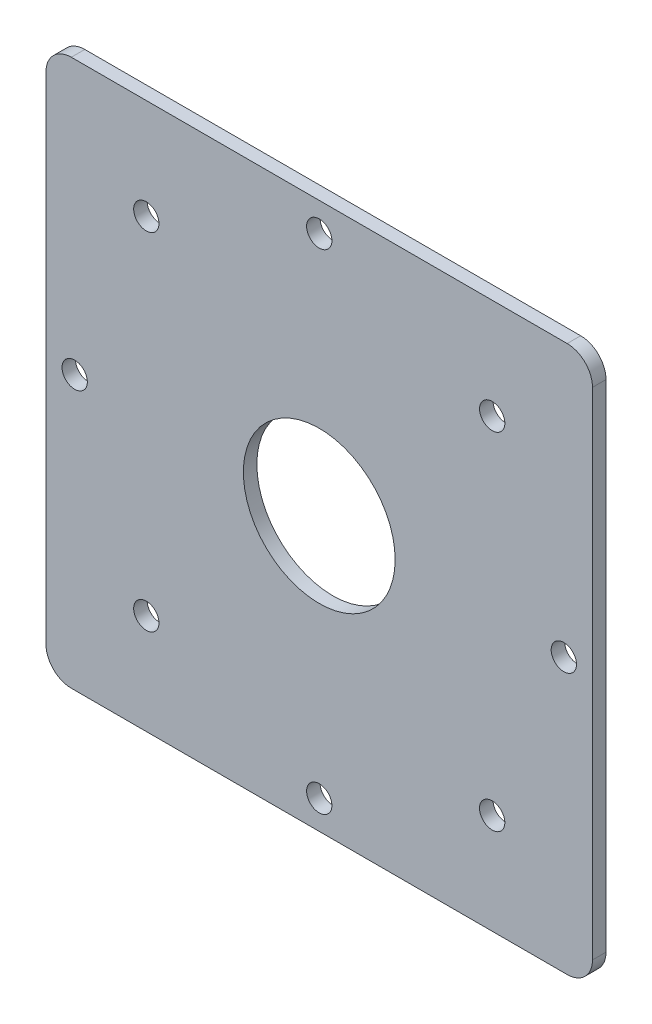
from build123d import *

# Parameters (mm, degrees)
SKETCH1_W           = 324
SKETCH1_H           = 324
BOSS_EXTRUDE1_DEPTH = 8
SKETCH2_R           = 7.5
CUT_EXTRUDE1_DEPTH  = 8
SKETCH3_R           = 45
CUT_EXTRUDE2_DEPTH  = 10
CIRPATTERN1_COUNT   = 8
FILLET1_R           = 15


with BuildPart() as part:
    # Sketch1 → Boss-Extrude1 (new body)
    with BuildSketch(Plane.XY):
        Rectangle(SKETCH1_W, SKETCH1_H)
    extrude(amount=BOSS_EXTRUDE1_DEPTH)

    # Sketch2 → Cut-Extrude1 (cut)
    with BuildSketch(Plane.XY.offset(8)):
        with Locations((0, 145)):
            Circle(SKETCH2_R)
    cut_extrude1 = extrude(amount=-CUT_EXTRUDE1_DEPTH, mode=Mode.SUBTRACT)

    # Sketch3 → Cut-Extrude2 (cut)
    with BuildSketch(Plane.XY.offset(8)):
        Circle(SKETCH3_R)
    extrude(amount=-CUT_EXTRUDE2_DEPTH, mode=Mode.SUBTRACT)

    # CirPattern1: Cut-Extrude1 ×8 about axis
    cirpattern1_axis = Axis((0, 0, 0), (0, 0, 1))
    for i in range(1, CIRPATTERN1_COUNT):
        add(cut_extrude1.rotate(cirpattern1_axis, i * 360 / CIRPATTERN1_COUNT), mode=Mode.SUBTRACT)

    # Fillet1
    fillet1_edges = [part.edges().sort_by_distance(p)[0] for p in [
        (162, -162, 4),
        (-162, -162, 4),
        (-162, 162, 4),
        (162, 162, 4),
    ]]
    fillet(fillet1_edges, radius=FILLET1_R)


solid = part.part
